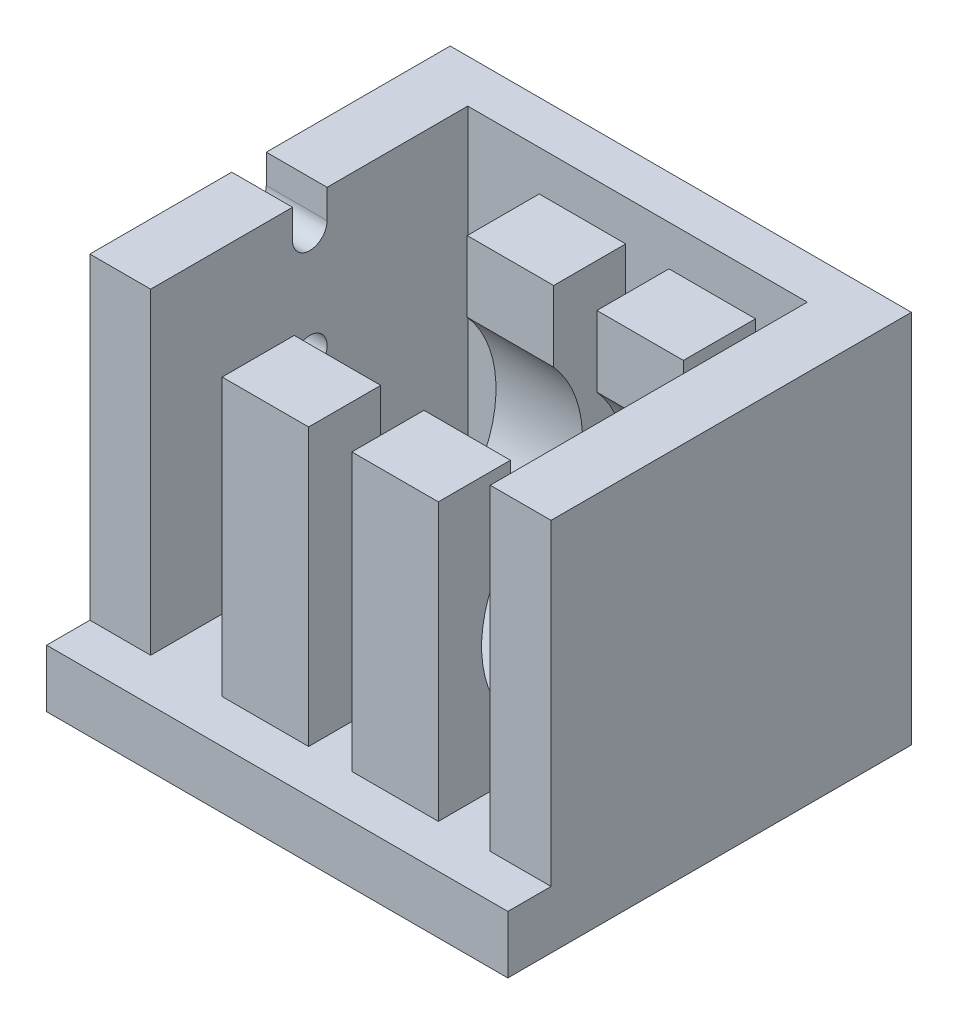
from build123d import *

# Parameters (mm, degrees)
CROQUIS1_W              = 16
CROQUIS1_H              = 14
SALIENTE_EXTRUIR1_DEPTH = 2
CROQUIS2_W              = 3
CROQUIS2_H              = 2.5
SALIENTE_EXTRUIR2_DEPTH = 13
CROQUIS4_W              = 3
CROQUIS4_H              = 2.5
CORTAR_EXTRUIR1_DEPTH   = 1.4
CORTAR_EXTRUIR2_START   = 2.480005
CROQUIS5_R              = 4
CORTAR_EXTRUIR2_DEPTH   = 7.5
CROQUIS7_2_R            = 0.6
CORTAR_EXTRUIR4_DEPTH   = 5
CROQUIS7_R              = 0.6
CORTAR_EXTRUIR3_DEPTH   = 4


with BuildPart() as part:
    # Croquis1 → Saliente-Extruir1 (new body)
    with BuildSketch(Plane(origin=(0, 0, 0), x_dir=(1, 0, 0), z_dir=(0, 1, 0))):
        Rectangle(CROQUIS1_W, CROQUIS1_H)
    extrude(amount=SALIENTE_EXTRUIR1_DEPTH)

    # Croquis2 → Saliente-Extruir2 (add)
    with BuildSketch(Plane(origin=(0, 0, 0), x_dir=(1, 0, 0), z_dir=(0, 1, 0))):
        Polygon((5.890002582, 5.5), (5.890002582, -5.5), (8, -5.5), (8, 7), (-8, 7), (-8, -5.5), (-5.890002582, -5.5), (-5.890002582, 5.5), (-3.409997418, 5.5), (-3.409997418, 3), (-0.409997418, 3), (-0.409997418, 5.5), (1.090002582, 5.5), (1.090002582, 3), (4.090002582, 3), (4.090002582, 5.5), align=None)
        with Locations((-1.909997418, -4.25)):
            Rectangle(CROQUIS2_W, CROQUIS2_H)
        with Locations((2.590002582, -4.25)):
            Rectangle(CROQUIS2_W, CROQUIS2_H)
    extrude(amount=SALIENTE_EXTRUIR2_DEPTH)

    # Croquis4 → Cortar-Extruir1 (cut)
    with BuildSketch(Plane(origin=(0, 13, 0), x_dir=(1, 0, 0), z_dir=(0, 1, 0))):
        with Locations((-1.909997418, -4.25)):
            Rectangle(CROQUIS4_W, CROQUIS4_H)
        with Locations((2.590002582, -4.25)):
            Rectangle(CROQUIS4_W, CROQUIS4_H)
        with Locations((2.590002582, 4.25)):
            Rectangle(CROQUIS4_W, CROQUIS4_H)
        with Locations((-1.909997418, 4.25)):
            Rectangle(CROQUIS4_W, CROQUIS4_H)
    extrude(amount=-CORTAR_EXTRUIR1_DEPTH, mode=Mode.SUBTRACT)

    # Croquis5 → Cortar-Extruir2 (cut)
    with BuildSketch(Plane(origin=(-5.890002582, 0, 0), x_dir=(0, 0, -1), z_dir=(1, 0, 0)).offset(CORTAR_EXTRUIR2_START)):
        with Locations((0, 6.5)):
            Circle(CROQUIS5_R)
    extrude(amount=CORTAR_EXTRUIR2_DEPTH, mode=Mode.SUBTRACT)

    # Croquis7<2> → Cortar-Extruir4 (cut)
    with BuildSketch(Plane(origin=(-5.890002582, 0, 0), x_dir=(0, 0, -1), z_dir=(1, 0, 0))):
        with Locations((0.020682753, 8.25)):
            Circle(CROQUIS7_2_R)
        with BuildLine():
            Line((-0.579317247, 12), (-0.579317247, 13))
            Line((-0.579317247, 13), (0.620682753, 13))
            Line((0.620682753, 13), (0.620682753, 12))
            ThreePointArc((0.620682753, 12), (0.020682753, 11.4), (-0.579317247, 12))
        make_face()
    extrude(amount=-CORTAR_EXTRUIR4_DEPTH, mode=Mode.SUBTRACT)

    # Croquis7 → Cortar-Extruir3 (cut)
    with BuildSketch(Plane(origin=(-5.890002582, 0, 0), x_dir=(0, 0, -1), z_dir=(1, 0, 0))):
        with Locations((0.020682753, 8.25)):
            Circle(CROQUIS7_R)
        with BuildLine():
            Line((-0.579317247, 12), (-0.579317247, 13))
            Line((-0.579317247, 13), (0.620682753, 13))
            Line((0.620682753, 13), (0.620682753, 12))
            ThreePointArc((0.620682753, 12), (0.020682753, 11.4), (-0.579317247, 12))
        make_face()
    extrude(amount=-CORTAR_EXTRUIR3_DEPTH, mode=Mode.SUBTRACT)


solid = part.part
